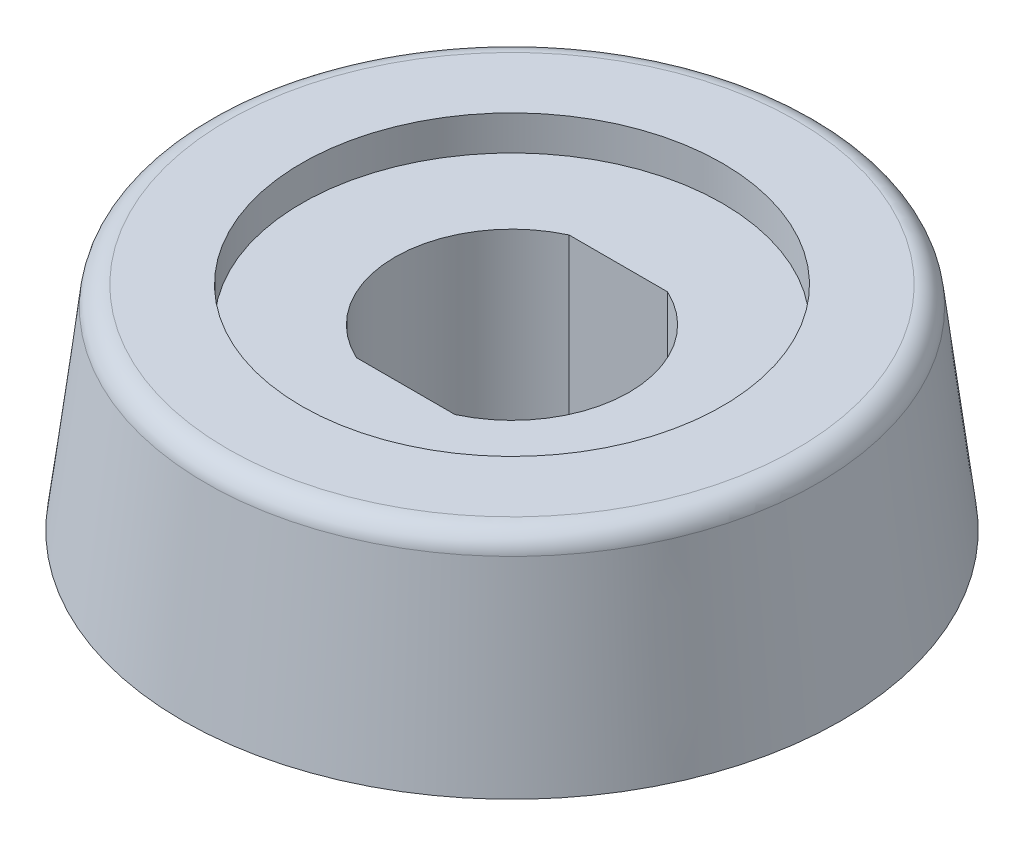
from build123d import *

# Parameters (mm, degrees)
SALIENTE_EXTRUIR1_DEPTH    = 4.9
SALIENTE_EXTRUIR1_DRAFT    = -7
CROQUIS2_R                 = 5.8
SALIENTE_EXTRUIR2_DEPTH    = 0.3
CORTAR_EXTRUIR1_DEPTH      = 20.267994836
CROQUIS4_R                 = 5.8
SALIENTE_EXTRUIR3_DEPTH    = 0.3
CORTAR_EXTRUIR2_DEPTH      = 20.267994836
CORTAR_EXTRUIR3_DEPTH      = 3.75
CROQUIS7_W                 = 4.85
CROQUIS7_H                 = 0.9
CROQUIS8_W                 = 4.85
CROQUIS8_H                 = 0.9
CROQUIS9_W                 = 3.415
CROQUIS9_H                 = 0.3
CROQUIS10_W                = 3.415
CROQUIS10_H                = 0.3
CORTAR_EXTRUIR8_DEPTH      = 20.18920595
CORTAR_EXTRUIR8_DEPTH_BACK = 20.18920595
CROQUIS11_OUTSIDE_W        = 43.344
CROQUIS11_OUTSIDE_H        = 24.694
CROQUIS11_OUTSIDE_R        = 6.99
CROQUIS20_R                = 7.6
CROQUIS20_R_2              = 5.8
SALIENTE_EXTRUIR11_DEPTH   = 4.9
SALIENTE_EXTRUIR11_DRAFT   = -7
REDONDEO6_R                = 0.5


with BuildPart() as part:
    # Croquis1 → Saliente-Extruir1 (with draft: the straight prism first)
    with BuildSketch(Plane.XZ):
        with BuildLine():
            Line((-9.325, -7.6), (9.325, -7.6))
            ThreePointArc((9.325, -7.6), (16.925, 0), (9.325, 7.6))
            Line((9.325, 7.6), (-9.325, 7.6))
            ThreePointArc((-9.325, 7.6), (-16.925, 0), (-9.325, -7.6))
        make_face()
    extrude(amount=-SALIENTE_EXTRUIR1_DEPTH)
    # Saliente-Extruir1: the draft: its side faces are tilted about the plane it starts from
    saliente_extruir1_sides = [part.faces().sort_by_distance(p)[0] for p in [
        (0, 2.45, -7.6),
        (16.925, 2.45, 0),
        (0, 2.45, 7.6),
        (-16.925, 2.45, 0),
    ]]
    draft(saliente_extruir1_sides, Plane.XZ, SALIENTE_EXTRUIR1_DRAFT)

    # Croquis2 → Saliente-Extruir2 (add)
    with BuildSketch(Plane.XZ):
        with Locations(Location((9.325, 0, 0), (0, 0, 270))):
            Circle(CROQUIS2_R)
    extrude(amount=SALIENTE_EXTRUIR2_DEPTH)

    # Croquis3 → Cortar-Extruir1 (cut, through all)
    with BuildSketch(Plane(origin=(0, 4.9, 0), x_dir=(-1, 0, 0), z_dir=(0, 1, 0))):
        with BuildLine():
            Line((-10.459680572, -2.45), (-8.190319428, -2.45))
            ThreePointArc((-8.190319428, -2.45), (-6.625, 0), (-8.190319428, 2.45))
            Line((-8.190319428, 2.45), (-10.459680572, 2.45))
            ThreePointArc((-10.459680572, 2.45), (-12.025, 0), (-10.459680572, -2.45))
        make_face()
    extrude(amount=-CORTAR_EXTRUIR1_DEPTH, mode=Mode.SUBTRACT)

    # Croquis4 → Saliente-Extruir3 (add)
    with BuildSketch(Plane.XZ):
        with Locations(Location((-9.325, 0, 0), (0, 0, 270))):
            Circle(CROQUIS4_R)
    extrude(amount=SALIENTE_EXTRUIR3_DEPTH)

    # Croquis5 → Cortar-Extruir2 (cut, through all)
    with BuildSketch(Plane(origin=(0, 4.9, 0), x_dir=(-1, 0, 0), z_dir=(0, 1, 0))):
        with BuildLine():
            Line((10.459680572, 2.45), (8.190319428, 2.45))
            ThreePointArc((8.190319428, 2.45), (6.625, 0), (8.190319428, -2.45))
            Line((8.190319428, -2.45), (10.459680572, -2.45))
            ThreePointArc((10.459680572, -2.45), (12.025, 0), (10.459680572, 2.45))
        make_face()
    extrude(amount=-CORTAR_EXTRUIR2_DEPTH, mode=Mode.SUBTRACT)

    # Croquis6 → Cortar-Extruir3 (cut)
    with BuildSketch(Plane.XZ):
        with BuildLine():
            Line((-2.15, 2.8), (-2.15, -2.8))
            ThreePointArc((-2.15, -2.8), (0, -4.95), (2.15, -2.8))
            Line((2.15, -2.8), (2.15, 2.8))
            ThreePointArc((2.15, 2.8), (0, 4.95), (-2.15, 2.8))
        make_face()
    extrude(amount=-CORTAR_EXTRUIR3_DEPTH, mode=Mode.SUBTRACT)

    # Croquis7 → Cortar-Revolución1 (revolve, cut)
    with BuildSketch(Plane(origin=(-9.325, 0, 0), x_dir=(0, 0, -1), z_dir=(1, 0, 0))):
        with Locations((2.425, 4.55)):
            Rectangle(CROQUIS7_W, CROQUIS7_H)
    revolve(axis=Axis((-9.325, 5, 0), (0, -1, 0)), mode=Mode.SUBTRACT)

    # Croquis8 → Cortar-Revolución2 (revolve, cut)
    with BuildSketch(Plane(origin=(9.325, 0, 0), x_dir=(0, 0, -1), z_dir=(1, 0, 0))):
        with Locations((2.425, 4.55)):
            Rectangle(CROQUIS8_W, CROQUIS8_H)
    revolve(axis=Axis((9.325, 5, 0), (0, -1, 0)), mode=Mode.SUBTRACT)

    # Croquis9 → Cortar-Revolución3 (revolve, cut)
    with BuildSketch(Plane(origin=(-9.325, 0, 0), x_dir=(0, 0, -1), z_dir=(1, 0, 0))):
        with Locations((1.7075, -0.15)):
            Rectangle(CROQUIS9_W, CROQUIS9_H)
    revolve(axis=Axis((-9.325, 0, 0), (0, -1, 0)), mode=Mode.SUBTRACT)

    # Croquis10 → Cortar-Revolución4 (revolve, cut)
    with BuildSketch(Plane(origin=(9.325, 0, 0), x_dir=(0, 0, -1), z_dir=(1, 0, 0))):
        with Locations((1.7075, -0.15)):
            Rectangle(CROQUIS10_W, CROQUIS10_H)
    revolve(axis=Axis((9.325, 0, 0), (0, -1, 0)), mode=Mode.SUBTRACT)

    # Croquis11 outside → Cortar-Extruir8 (cut, two sides: drawn at the far end of the back side and taken through both)
    with BuildSketch(Plane(origin=(0, 0, 0), x_dir=(1, 0, 0), z_dir=(0, 1, 0)).offset(-CORTAR_EXTRUIR8_DEPTH_BACK)):
        Rectangle(CROQUIS11_OUTSIDE_W, CROQUIS11_OUTSIDE_H)
        with Locations(Location((-9.325, 0, 0), (0, 0, 270))):
            Circle(CROQUIS11_OUTSIDE_R, mode=Mode.SUBTRACT)
    extrude(amount=CORTAR_EXTRUIR8_DEPTH + CORTAR_EXTRUIR8_DEPTH_BACK, mode=Mode.SUBTRACT)


with BuildPart() as saliente_extruir11_tool:
    # Croquis20 → Saliente-Extruir11 (with draft: the straight prism first)
    with BuildSketch(Plane.XZ):
        with Locations((-9.325, 0)):
            Circle(CROQUIS20_R)
        with Locations(Location((-9.325, 0, 0), (0, 0, 270))):
            Circle(CROQUIS20_R_2, mode=Mode.SUBTRACT)
    extrude(amount=-SALIENTE_EXTRUIR11_DEPTH)
    # Saliente-Extruir11: the draft: its side faces are tilted about the plane it starts from
    saliente_extruir11_sides = [saliente_extruir11_tool.faces().sort_by_distance(p)[0] for p in [
        (-16.925, 2.45, 0),
        (-9.325, 2.45, 5.8),
    ]]
    draft(saliente_extruir11_sides, Plane.XZ, SALIENTE_EXTRUIR11_DRAFT)


with BuildPart() as part_1:
    add(part.part)

    # Saliente-Extruir11: add saliente_extruir11_tool
    add(saliente_extruir11_tool.part)

    # Redondeo6
    redondeo6_edges = [part_1.edges().sort_by_distance(p)[0] for p in [
        (-16.323355652, 4.9, 0),
    ]]
    fillet(redondeo6_edges, radius=REDONDEO6_R)


solid = part_1.part
